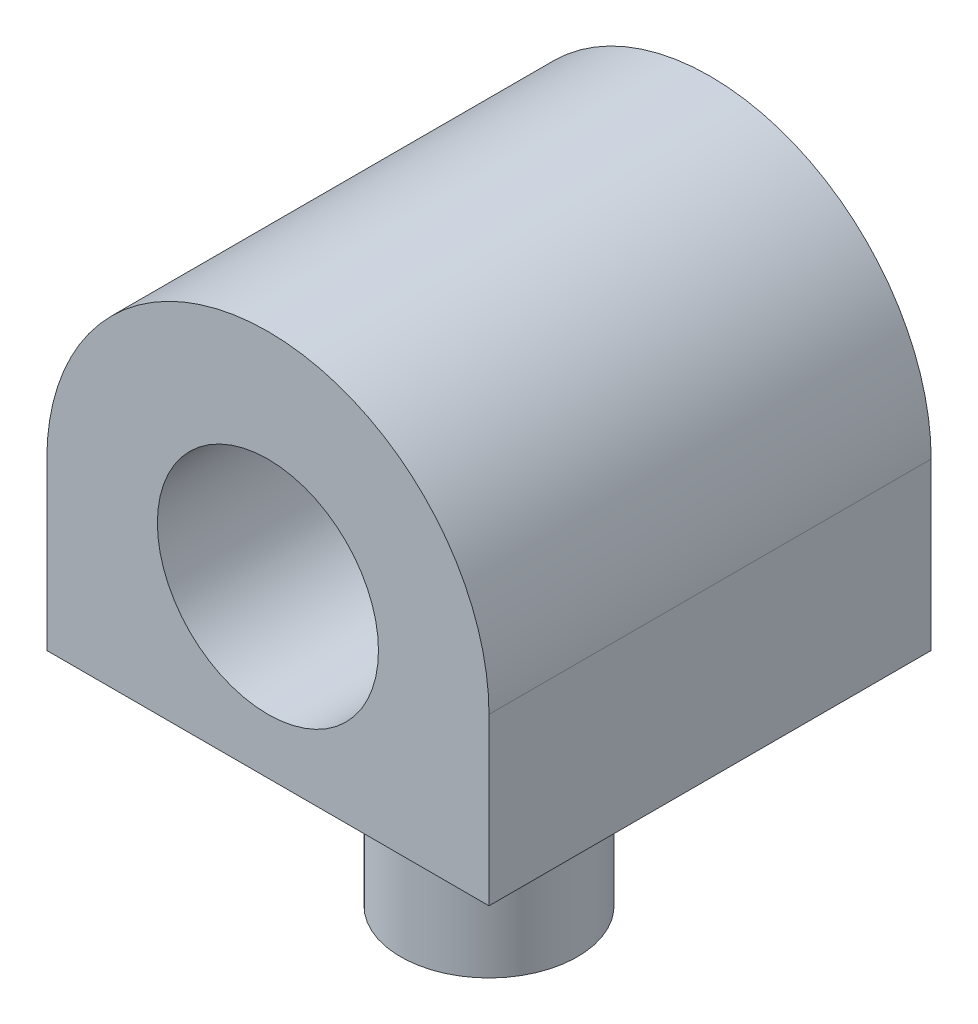
from build123d import *

# Parameters (mm, degrees)
EXTRUDE_1_DEPTH     = 20
SKETCH_3_R          = 5
CUT_EXTRUDE_1_DEPTH = 25.494897428
SKETCH_5_R          = 4
EXTRUDE_2_DEPTH     = 10


with BuildPart() as part:
    # ｽｹｯﾁ2 → ﾎﾞｽ - 押し出し1 (new body)
    with BuildSketch(Plane.XY):
        with BuildLine():
            Line((-10, 0), (-10, -7.5))
            Line((-10, -7.5), (10, -7.5))
            Line((10, -7.5), (10, 0))
            ThreePointArc((10, 0), (0, 10), (-10, 0))
        make_face()
    extrude(amount=EXTRUDE_1_DEPTH)

    # ｽｹｯﾁ3 → ｶｯﾄ - 押し出し1 (cut, through all)
    with BuildSketch(Plane.XY.offset(20)):
        Circle(SKETCH_3_R)
    extrude(amount=-CUT_EXTRUDE_1_DEPTH, mode=Mode.SUBTRACT)

    # ｽｹｯﾁ5 → ﾎﾞｽ - 押し出し2 (add)
    with BuildSketch(Plane(origin=(0, -7.5, 0), x_dir=(-1, 0, 0), z_dir=(0, -1, 0))):
        with Locations(Location((0, -10, 0), (0, 0, 90))):
            Circle(SKETCH_5_R)
    extrude(amount=EXTRUDE_2_DEPTH)


solid = part.part
